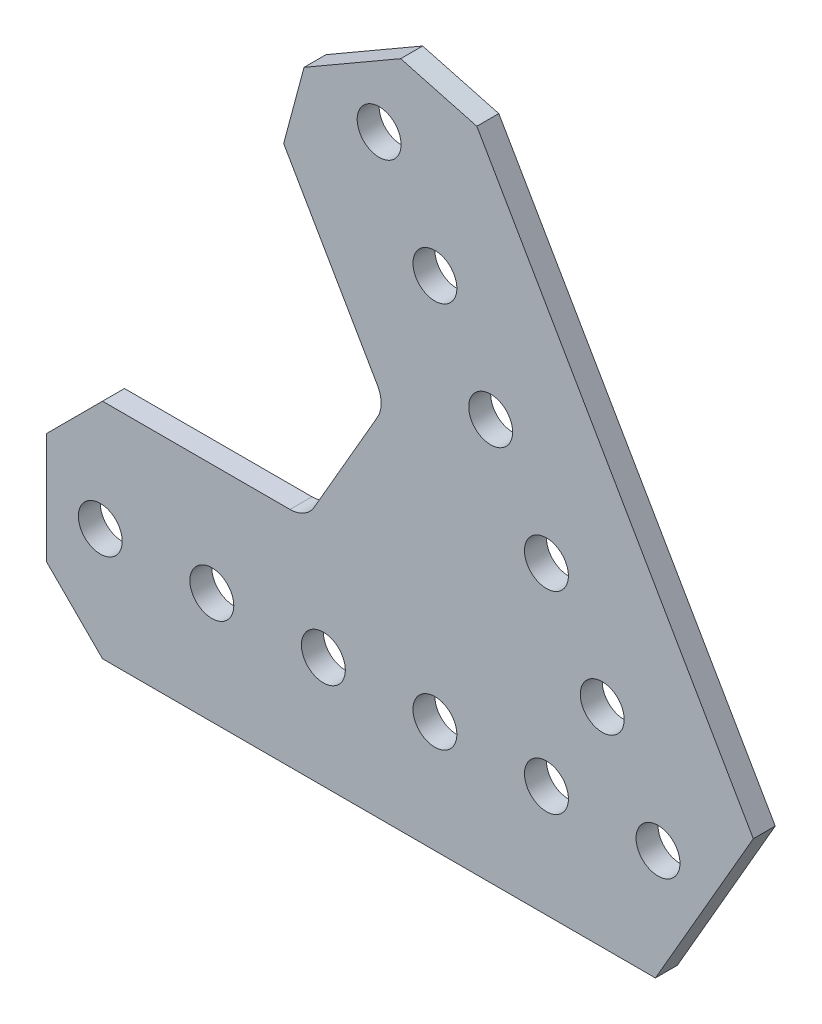
from build123d import *

# Parameters (mm, degrees)
SKETCH1_R           = 2.5
BOSS_EXTRUDE1_DEPTH = 2.5


with BuildPart() as part:
    # Sketch1 → Boss-Extrude1 (new body)
    with BuildSketch(Plane(origin=(0, 0, -1.25), x_dir=(-1, 0, 0), z_dir=(0, 0, -1))):
        with BuildLine():
            Line((0.293293937, -12.7), (63.246, -12.7))
            Line((63.246, -12.7), (69.596, -6.35))
            Line((69.596, -6.35), (69.596, 6.35))
            Line((69.596, 6.35), (63.246, 12.7))
            Line((63.246, 12.7), (41.897783942, 12.7))
            ThreePointArc((41.897783942, 12.7), (40.310283942, 13.125369343), (39.148153285, 14.2875))
            Line((39.148153285, 14.2875), (31.947414599, 26.759545256))
            ThreePointArc((31.947414599, 26.759545256), (31.522045256, 28.347045256), (31.947414599, 29.934545256))
            Line((31.947414599, 29.934545256), (42.621522628, 48.422642688))
            Line((42.621522628, 48.422642688), (40.297261314, 57.096904002))
            Line((40.297261314, 57.096904002), (29.298738686, 63.446904002))
            Line((29.298738686, 63.446904002), (20.624477372, 61.122642688))
            Line((20.624477372, 61.122642688), (-10.85187566, 6.604))
            Line((-10.85187566, 6.604), (0.293293937, -12.7))
        make_face()
        with Locations(Location((12.7, 0, 0), (0, 0, 180))):
            Circle(SKETCH1_R, mode=Mode.SUBTRACT)
        with Locations(Location((25.4, 0, 0), (0, 0, 180))):
            Circle(SKETCH1_R, mode=Mode.SUBTRACT)
        with Locations(Location((38.1, 0, 0), (0, 0, 180))):
            Circle(SKETCH1_R, mode=Mode.SUBTRACT)
        with Locations(Location((0, 0, 0), (0, 0, 180))):
            Circle(SKETCH1_R, mode=Mode.SUBTRACT)
        with Locations(Location((63.5, 0, 0), (0, 0, 180))):
            Circle(SKETCH1_R, mode=Mode.SUBTRACT)
        with Locations(Location((50.8, 0, 0), (0, 0, 180))):
            Circle(SKETCH1_R, mode=Mode.SUBTRACT)
        with Locations(Location((31.75, 54.99261314, 0), (0, 0, 180))):
            Circle(SKETCH1_R, mode=Mode.SUBTRACT)
        with Locations(Location((25.4, 43.994090512, 0), (0, 0, 180))):
            Circle(SKETCH1_R, mode=Mode.SUBTRACT)
        with Locations(Location((19.05, 32.995567884, 0), (0, 0, 180))):
            Circle(SKETCH1_R, mode=Mode.SUBTRACT)
        with Locations(Location((12.7, 21.997045256, 0), (0, 0, 180))):
            Circle(SKETCH1_R, mode=Mode.SUBTRACT)
        with Locations(Location((6.35, 10.998522628, 0), (0, 0, 180))):
            Circle(SKETCH1_R, mode=Mode.SUBTRACT)
    extrude(amount=-BOSS_EXTRUDE1_DEPTH)


solid = part.part
